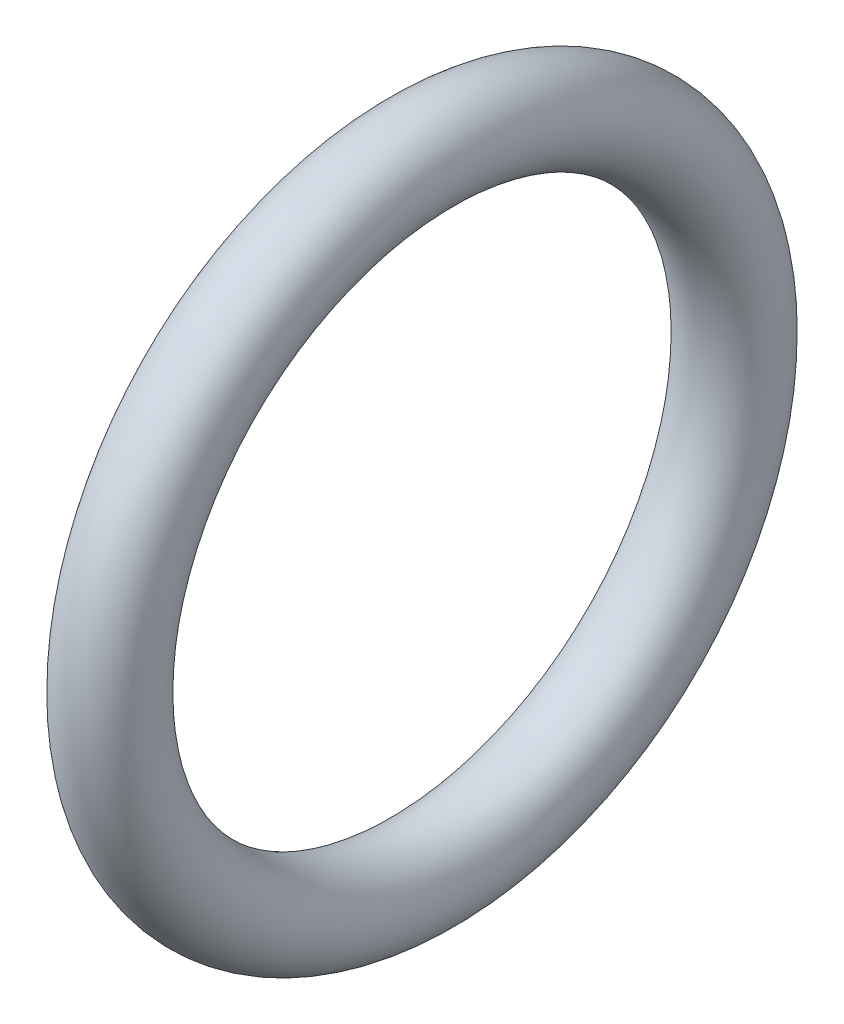
from build123d import *

# Parameters (mm, degrees)
ESQUISSE1_R = 1.5


with BuildPart() as part:
    # Esquisse1 → Révolution1 (revolve)
    with BuildSketch(Plane.XY, mode=Mode.PRIVATE) as r_volution1_sk:
        with Locations((0, 10.5)):
            Circle(ESQUISSE1_R)
    revolve(r_volution1_sk.sketch.rotate(Axis((-17.272, 0, 0), (1, 0, 0)), 90), axis=Axis((-17.272, 0, 0), (1, 0, 0)))


solid = part.part
